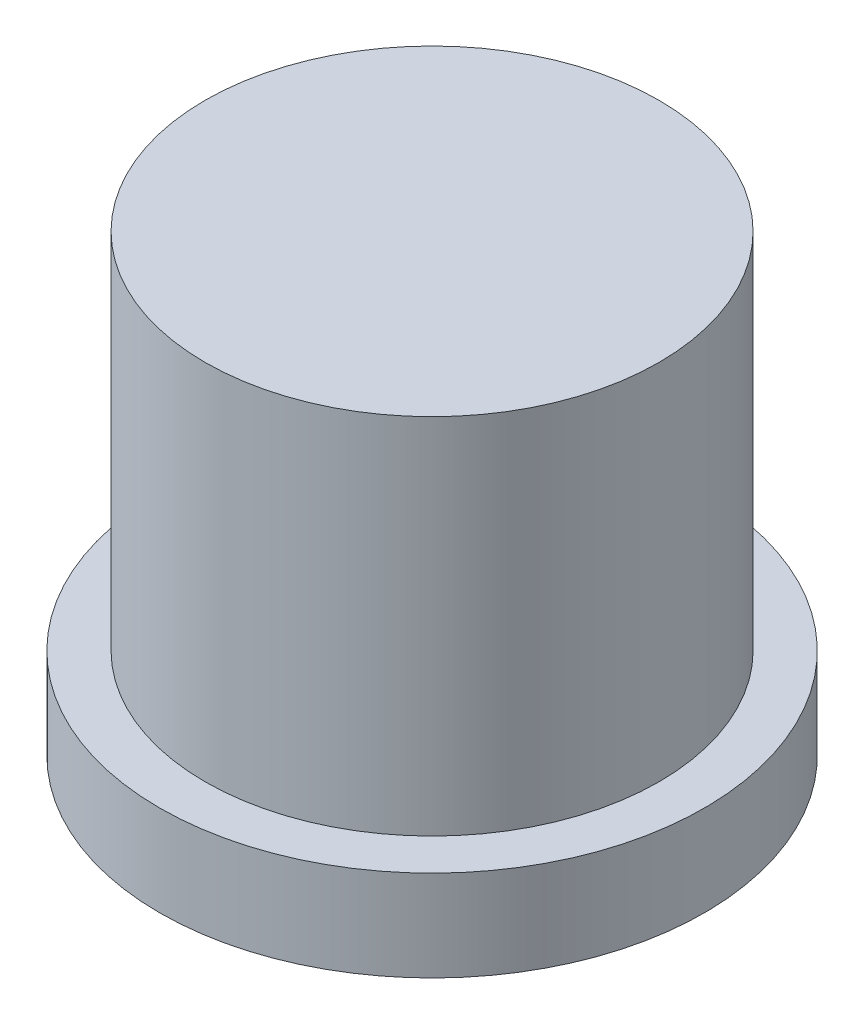
from build123d import *

# Parameters (mm, degrees)
SKETCH1_R           = 5
BOSS_EXTRUDE1_DEPTH = 10
SKETCH1_3_R         = 6
SKETCH1_3_R_2       = 5
BOSS_EXTRUDE2_DEPTH = 2


with BuildPart() as part:
    # Sketch1 → Boss-Extrude1 (new body)
    with BuildSketch(Plane(origin=(0, 0, 0), x_dir=(1, 0, 0), z_dir=(0, 1, 0))):
        Circle(SKETCH1_R)
    extrude(amount=BOSS_EXTRUDE1_DEPTH)

    # Sketch1<3> → Boss-Extrude2 (add)
    with BuildSketch(Plane(origin=(0, 0, 0), x_dir=(1, 0, 0), z_dir=(0, 1, 0))):
        Circle(SKETCH1_3_R)
        Circle(SKETCH1_3_R_2, mode=Mode.SUBTRACT)
    extrude(amount=BOSS_EXTRUDE2_DEPTH)


solid = part.part
